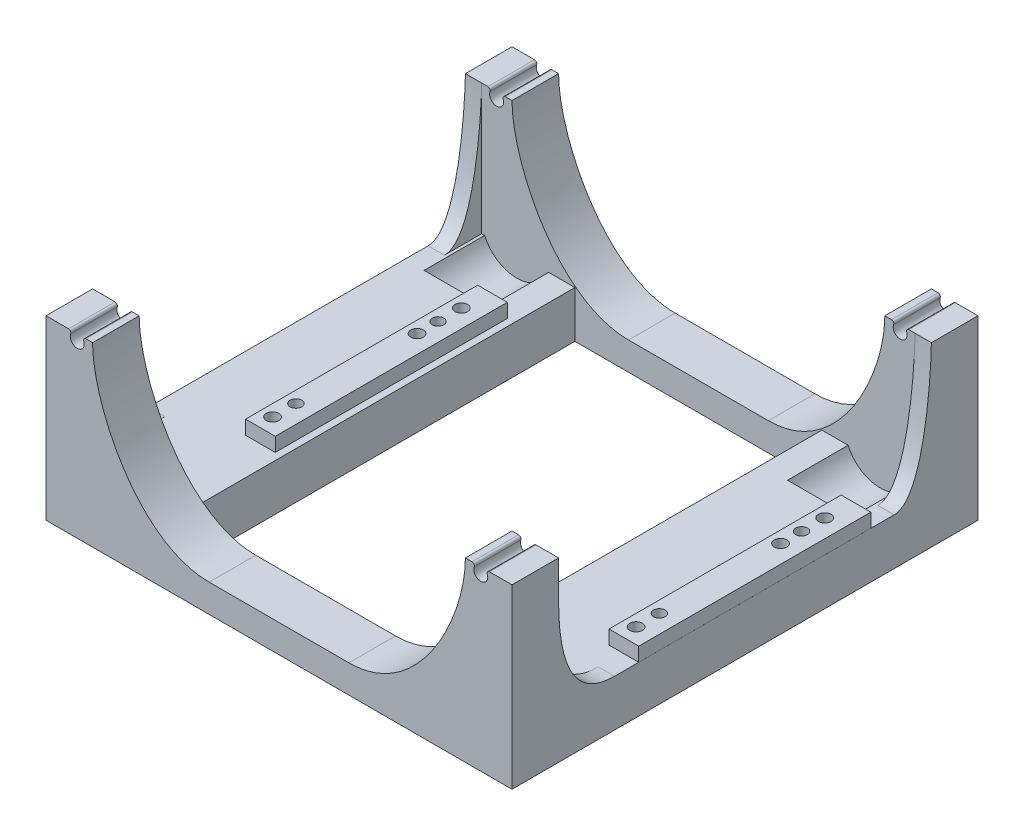
from build123d import *

# Parameters (mm, degrees)
SKETCH_1_W          = 100
SKETCH_1_H          = 100
EXTRUDE_1_DEPTH     = 3
SKETCH_2_W          = 10
SKETCH_2_H          = 10
EXTRUDE_2_DEPTH     = 35
CUT_EXTRUDE_START   = -100
SKETCH_5_R          = 1.5
CUT_EXTRUDE_2_DEPTH = 100
FILLET_1_R          = 0.5
SKETCH_7_W          = 80
SKETCH_7_H          = 10
EXTRUDE_3_DEPTH     = 3
EXTRUDE_4_DEPTH     = 10
EXTRUDE_5_DEPTH     = 10
SKETCH_13_W         = 23.5
SKETCH_13_H         = 80
EXTRUDE_6_DEPTH     = 7
EXTRUDE_8_DEPTH     = 3.5
EXTRUDE_9_DEPTH     = 3.5
SKETCH_12_R         = 7.5
CUT_EXTRUDE_3_DEPTH = 13
SKETCH_14_W         = 6.37
SKETCH_14_H         = 49.8
SKETCH_14_R         = 1.35
SKETCH_14_R_2       = 1.25
EXTRUDE_7_DEPTH     = 3
SKETCH_3_W          = 53
SKETCH_3_H          = 80
CUT_EXTRUDE_1_DEPTH = 3


with BuildPart() as part:
    # 草图1 → 凸台-拉伸1 (new body)
    with BuildSketch(Plane(origin=(0, 0, 0), x_dir=(1, 0, 0), z_dir=(0, 1, 0))):
        Rectangle(SKETCH_1_W, SKETCH_1_H)
    extrude(amount=EXTRUDE_1_DEPTH)

    # 草图2 → 凸台-拉伸2 (add)
    with BuildSketch(Plane(origin=(0, 3, 0), x_dir=(1, 0, 0), z_dir=(0, 1, 0))):
        with Locations((45, 45)):
            Rectangle(SKETCH_2_W, SKETCH_2_H)
        with Locations((-45, 45)):
            Rectangle(SKETCH_2_W, SKETCH_2_H)
        with Locations((45, -45)):
            Rectangle(SKETCH_2_W, SKETCH_2_H)
        with Locations((-45, -45)):
            Rectangle(SKETCH_2_W, SKETCH_2_H)
    extrude(amount=EXTRUDE_2_DEPTH)

    # 草图5 → 切除-拉伸2 (cut)
    with BuildSketch(Plane(origin=(0, 0, -50), x_dir=(-1, 0, 0), z_dir=(0, 0, -1)).offset(CUT_EXTRUDE_START)):
        with Locations((-43.3, 36.8)):
            Circle(SKETCH_5_R)
        with Locations((43.3, 36.8)):
            Circle(SKETCH_5_R)
    extrude(amount=CUT_EXTRUDE_2_DEPTH, mode=Mode.SUBTRACT)

    # 圆角1
    fillet_1_edges = [part.edges().sort_by_distance(p)[0] for p in [
        (-44.2, 38, 45),
        (-42.4, 38, 45),
        (42.4, 38, 45),
        (44.2, 38, 45),
        (-42.4, 38, -45),
        (-44.2, 38, -45),
        (44.2, 38, -45),
        (42.4, 38, -45),
    ]]
    fillet(fillet_1_edges, radius=FILLET_1_R)

    # 草图7 → 凸台-拉伸3 (add)
    with BuildSketch(Plane(origin=(0, 3, 0), x_dir=(1, 0, 0), z_dir=(0, 1, 0))):
        with Locations((0, -45)):
            Rectangle(SKETCH_7_W, SKETCH_7_H)
        with Locations((0, 45)):
            Rectangle(SKETCH_7_W, SKETCH_7_H)
    extrude(amount=EXTRUDE_3_DEPTH)

    # 草图8 → 凸台-拉伸4 (add)
    with BuildSketch(Plane.XY.offset(50)):
        with BuildLine():
            Line((-40, 38), (-40, 6))
            Line((-40, 6), (-15, 6))
            add(Edge.make_bspline(
                [(-40, 38), (-40, 26.493596618), (-30.150326601, 6), (-15, 6)],
                knots=[0, 0, 0, 0, 1, 1, 1, 1], degree=3))
        make_face()
        with BuildLine():
            Line((40, 6), (15, 6))
            add(Edge.make_bspline(
                [(40, 38), (40, 26.493596618), (30.150326601, 6), (15, 6)],
                knots=[0, 0, 0, 0, 1, 1, 1, 1], degree=3))
            Line((40, 38), (40, 6))
        make_face()
    extrude(amount=-EXTRUDE_4_DEPTH)

    # 草图9 → 凸台-拉伸5 (add)
    with BuildSketch(Plane(origin=(0, 0, -50), x_dir=(-1, 0, 0), z_dir=(0, 0, -1))):
        with BuildLine():
            Line((-40, 6), (-15, 6))
            add(Edge.make_bspline(
                [(-15, 6), (-30.150326601, 6), (-40, 26.493596618), (-40, 38)],
                knots=[0, 0, 0, 0, 1, 1, 1, 1], degree=3))
            Line((-40, 38), (-40, 6))
        make_face()
        with BuildLine():
            Line((40, 6), (40, 38))
            add(Edge.make_bspline(
                [(40, 38), (40, 26.493596618), (30.150326601, 6), (15, 6)],
                knots=[0, 0, 0, 0, 1, 1, 1, 1], degree=3))
            Line((15, 6), (40, 6))
        make_face()
    extrude(amount=-EXTRUDE_5_DEPTH)

    # 草图13 → 凸台-拉伸6 (add)
    with BuildSketch(Plane(origin=(0, 3, 0), x_dir=(1, 0, 0), z_dir=(0, 1, 0))):
        with Locations((-38.25, 0)):
            Rectangle(SKETCH_13_W, SKETCH_13_H)
        with Locations((38.25, 0)):
            Rectangle(SKETCH_13_W, SKETCH_13_H)
    extrude(amount=EXTRUDE_6_DEPTH)

    # 草图17 → 凸台-拉伸8 (add)
    with BuildSketch(Plane(origin=(50, 0, 0), x_dir=(0, 0, -1), z_dir=(1, 0, 0))):
        with BuildLine():
            Line((32, 10), (40, 10))
            Line((40, 10), (40, 38))
            add(Edge.make_bspline(
                [(40, 38), (40, 35.102252049), (38.976100097, 10), (32, 10)],
                knots=[0, 0, 0, 0, 1, 1, 1, 1], degree=3))
        make_face()
        with BuildLine():
            Line((-40, 30), (-40, 10))
            Line((-40, 10), (-28, 10))
            add(Edge.make_bspline(
                [(-40, 30), (-40, 10), (-28, 10)],
                knots=[0, 0, 0, 1, 1, 1], degree=2))
        make_face()
    extrude(amount=-EXTRUDE_8_DEPTH)

    # 草图18 → 凸台-拉伸9 (add)
    with BuildSketch(Plane.ZY.offset(50)):
        with BuildLine():
            Line((40, 10), (40, 30))
            add(Edge.make_bspline(
                [(40, 30), (40, 10), (28, 10)],
                knots=[0, 0, 0, 1, 1, 1], degree=2))
            Line((28, 10), (40, 10))
        make_face()
        with BuildLine():
            Line((-40, 10), (-32, 10))
            add(Edge.make_bspline(
                [(-32, 10), (-38.976100097, 10), (-40, 35.102252049), (-40, 38)],
                knots=[0, 0, 0, 0, 1, 1, 1, 1], degree=3))
            Line((-40, 38), (-40, 10))
        make_face()
    extrude(amount=-EXTRUDE_9_DEPTH)

    # 草图12 → 切除-拉伸3 (cut)
    with BuildSketch(Plane.XY.offset(-40)):
        with Locations((-39, 13)):
            Circle(SKETCH_12_R)
        with Locations((39, 13)):
            Circle(SKETCH_12_R)
    extrude(amount=CUT_EXTRUDE_3_DEPTH, mode=Mode.SUBTRACT)

    # 草图14 → 凸台-拉伸7 (add)
    # profile 1 of 2: a face of its own
    with BuildSketch(Plane(origin=(0, 10, 0), x_dir=(1, 0, 0), z_dir=(0, 1, 0))):
        with Locations((-31.188863542, 2.1)):
            Rectangle(SKETCH_14_W, SKETCH_14_H)
        with Locations(Location((-31.873863542, 21, 0), (0, 0, 270))):
            Circle(SKETCH_14_R, mode=Mode.SUBTRACT)
        with Locations(Location((-31.873863542, 16, 0), (0, 0, 270))):
            Circle(SKETCH_14_R_2, mode=Mode.SUBTRACT)
        with Locations(Location((-31.873863542, 11.5, 0), (0, 0, 270))):
            Circle(SKETCH_14_R, mode=Mode.SUBTRACT)
        with Locations(Location((-31.873863542, -14.5, 0), (0, 0, 270))):
            Circle(SKETCH_14_R_2, mode=Mode.SUBTRACT)
        with Locations(Location((-31.873863542, -19.5, 0), (0, 0, 270))):
            Circle(SKETCH_14_R, mode=Mode.SUBTRACT)
    # profile 2 of 2: a face of its own
    with BuildSketch(Plane(origin=(0, 10, 0), x_dir=(1, 0, 0), z_dir=(0, 1, 0))):
        with Locations((46.811136458, 2.1)):
            Rectangle(SKETCH_14_W, SKETCH_14_H)
        with Locations(Location((46.126136458, 21, 0), (0, 0, 270))):
            Circle(SKETCH_14_R, mode=Mode.SUBTRACT)
        with Locations(Location((46.126136458, 16, 0), (0, 0, 270))):
            Circle(SKETCH_14_R_2, mode=Mode.SUBTRACT)
        with Locations(Location((46.126136458, 11.5, 0), (0, 0, 270))):
            Circle(SKETCH_14_R, mode=Mode.SUBTRACT)
        with Locations(Location((46.126136458, -14.5, 0), (0, 0, 270))):
            Circle(SKETCH_14_R_2, mode=Mode.SUBTRACT)
        with Locations(Location((46.126136458, -19.5, 0), (0, 0, 270))):
            Circle(SKETCH_14_R, mode=Mode.SUBTRACT)
    extrude(amount=EXTRUDE_7_DEPTH)

    # 草图3 → 切除-拉伸1 (cut)
    with BuildSketch(Plane(origin=(0, 3, 0), x_dir=(1, 0, 0), z_dir=(0, 1, 0))):
        Rectangle(SKETCH_3_W, SKETCH_3_H)
    extrude(amount=-CUT_EXTRUDE_1_DEPTH, mode=Mode.SUBTRACT)


solid = part.part
